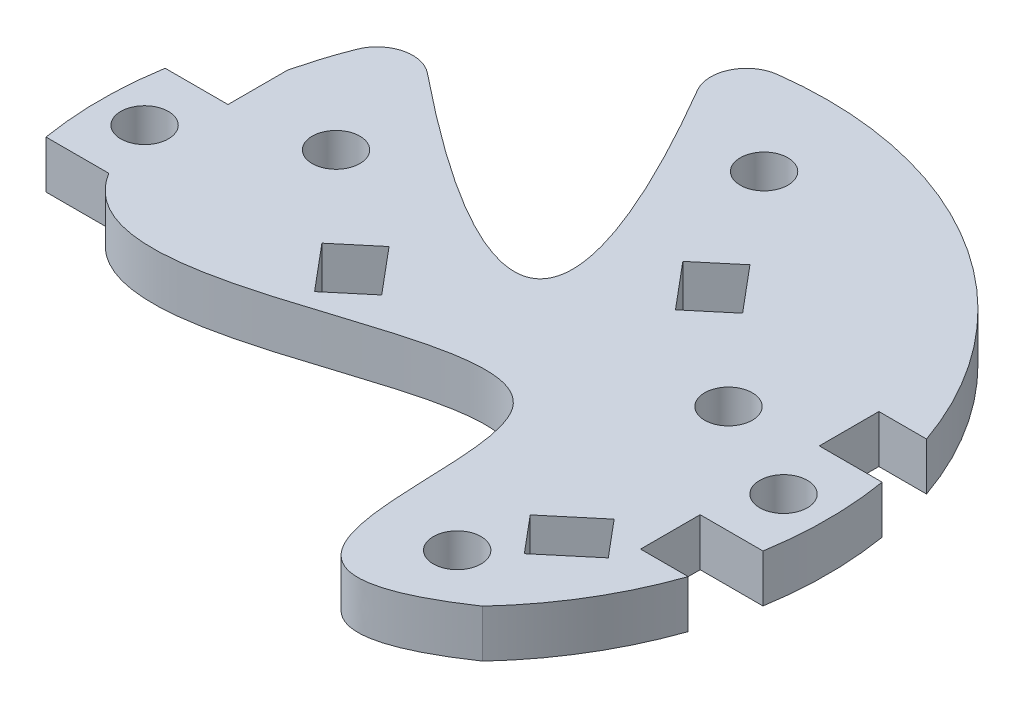
from build123d import *

# Parameters (mm, degrees)
CROQUIS1_R              = 30.5
SALIENTE_EXTRUIR1_DEPTH = 4
CORTAR_EXTRUIR3_START   = -4
CORTAR_EXTRUIR3_DEPTH   = 4
CORTAR_EXTRUIR6_START   = -10
CROQUIS9_R              = 2
CORTAR_EXTRUIR6_DEPTH   = 10
REDONDEO1_R             = 3
CROQUIS10_R             = 2
CORTAR_EXTRUIR7_DEPTH   = 4


with BuildPart() as part:
    # Croquis1 → Saliente-Extruir1 (new body)
    with BuildSketch(Plane(origin=(0, 0, 0), x_dir=(1, 0, 0), z_dir=(0, 1, 0))):
        with Locations(Location((0, 0, 0), (0, 0, 270))):
            Circle(CROQUIS1_R)
    extrude(amount=SALIENTE_EXTRUIR1_DEPTH)

    # Croquis5 → Cortar-Extruir3 (cut)
    with BuildSketch(Plane(origin=(0, 4, 0), x_dir=(1, 0, 0), z_dir=(0, 1, 0)).offset(CORTAR_EXTRUIR3_START)):
        with BuildLine():
            Line((28.814059068, 5), (30.087372767, 5))
            ThreePointArc((30.087372767, 5), (29.556634924, 7.526973624), (28.814059068, 10))
            Line((28.814059068, 10), (24.814059068, 10))
            Line((24.814059068, 10), (24.814059068, 5))
            Line((24.814059068, 5), (28.814059068, 5))
        make_face()
        with BuildLine():
            Line((30.087372767, -5), (28.814059068, -5))
            Line((28.814059068, -5), (24.814059068, -5))
            Line((24.814059068, -5), (24.814059068, -10))
            Line((24.814059068, -10), (28.814059068, -10))
            ThreePointArc((28.814059068, -10), (29.556634924, -7.526973624), (30.087372767, -5))
        make_face()
        with BuildLine():
            Line((-24.814059068, 5), (-24.814059068, 10))
            Line((-24.814059068, 10), (-28.814059068, 10))
            ThreePointArc((-28.814059068, 10), (-29.556634924, 7.526973624), (-30.087372767, 5))
            Line((-30.087372767, 5), (-28.814059068, 5))
            Line((-28.814059068, 5), (-24.814059068, 5))
        make_face()
        with BuildLine():
            Line((-28.814059068, -10), (-24.814059068, -10))
            Line((-24.814059068, -10), (-24.814059068, -5))
            Line((-24.814059068, -5), (-28.814059068, -5))
            Line((-28.814059068, -5), (-30.087372767, -5))
            ThreePointArc((-30.087372767, -5), (-29.556634924, -7.526973624), (-28.814059068, -10))
        make_face()
    extrude(amount=CORTAR_EXTRUIR3_DEPTH, mode=Mode.SUBTRACT)

    # Croquis9 → Cortar-Extruir6 (cut)
    with BuildSketch(Plane(origin=(0, 4, 0), x_dir=(1, 0, 0), z_dir=(0, 1, 0)).offset(CORTAR_EXTRUIR6_START)):
        Polygon((5.673284852, 12.685390231), (7.280253876, 10.770279124), (8.887222901, 8.855168016), (11.951400673, 11.426318455), (8.737462625, 15.25654067), align=None)
        Polygon((-10.796670675, -1.134543377), (-7.582732627, -4.964765592), (-4.518554854, -2.393615154), (-7.732492903, 1.436607062), align=None)
        with BuildLine():
            add(Edge.make_bspline(
                [(-10.646910399, -7.535916031), (-16.512406299, -9.080989315), (-22.046756553, -9.526586799), (-24.814059068, -5)],
                knots=[0.7678792, 0.7678792, 0.7678792, 0.7678792, 1, 1, 1, 1], degree=3))
            Line((-24.814059068, -5), (-24.814059068, -10))
            Line((-24.814059068, -10), (-28.814059068, -10))
            ThreePointArc((-28.814059068, -10), (-6.288730728, -29.84462876), (22.328940845, -20.776631121))
            add(Edge.make_bspline(
                [(22.328940845, -20.776631121), (5.973751648, -31.851207958), (18.415722084, 4.766196666), (-2.50799159, -5.391983749), (-10.646910399, -7.535916031)],
                knots=[0, 0, 0, 0, 0.445790092, 0.7678792, 0.7678792, 0.7678792, 0.7678792], degree=3))
        make_face()
        with BuildLine():
            add(Edge.make_bspline(
                [(-18.745320889, 15.664553597), (3.867000935, -2.576496257), (8.094246487, 2.496379136), (-8.307345659, 29.346856869)],
                knots=[0.040527546, 0.040527546, 0.040527546, 0.040527546, 1, 1, 1, 1], degree=3))
            ThreePointArc((-8.307345659, 29.346856869), (-20.930238649, 22.185019948), (-28.814059068, 10))
            Line((-28.814059068, 10), (-24.814059068, 10))
            add(Edge.make_bspline(
                [(-24.814059068, 10), (-24.456478323, 11.504954743), (-23.99064654, 12.985671633), (-23.418905183, 14.432273611)],
                knots=[0.635079884, 0.635079884, 0.635079884, 0.635079884, 0.831813486, 0.831813486, 0.831813486, 0.831813486], degree=3))
            ThreePointArc((-23.418905183, 14.432273611), (-21.393777069, 16.230440533), (-18.745320889, 15.664553597))
        make_face()
        Polygon((21.527275636, -8.931176939), (17.69705342, -12.145114987), (20.268203859, -15.20929276), (24.098426074, -11.995354711), align=None)
        with Locations(Location((2.550631881, 22.629718435, 0), (0, 0, 270))):
            Circle(CROQUIS9_R)
        with Locations(Location((18.138231416, 4.05314069, 0), (0, 0, 270))):
            Circle(CROQUIS9_R)
        with Locations(Location((-16.983501418, 6.238634388, 0), (0, 0, 270))):
            Circle(CROQUIS9_R)
        with Locations(Location((17.204026086, -17.780443199, 0), (0, 0, 270))):
            Circle(CROQUIS9_R)
    extrude(amount=CORTAR_EXTRUIR6_DEPTH, mode=Mode.SUBTRACT)

    # Redondeo1
    redondeo1_edges = [part.edges().sort_by_distance(p)[0] for p in [
        (-8.307345659, 2, -29.346856869),
    ]]
    fillet(redondeo1_edges, radius=REDONDEO1_R)

    # Croquis10 → Cortar-Extruir7 (cut)
    with BuildSketch(Plane(origin=(0, 4, 0), x_dir=(1, 0, 0), z_dir=(0, 1, 0))):
        with Locations(Location((-26.814059068, 0, 0), (0, 0, 270))):
            Circle(CROQUIS10_R)
        with Locations(Location((26.814059068, 0, 0), (0, 0, 270))):
            Circle(CROQUIS10_R)
    extrude(amount=-CORTAR_EXTRUIR7_DEPTH, mode=Mode.SUBTRACT)


solid = part.part
